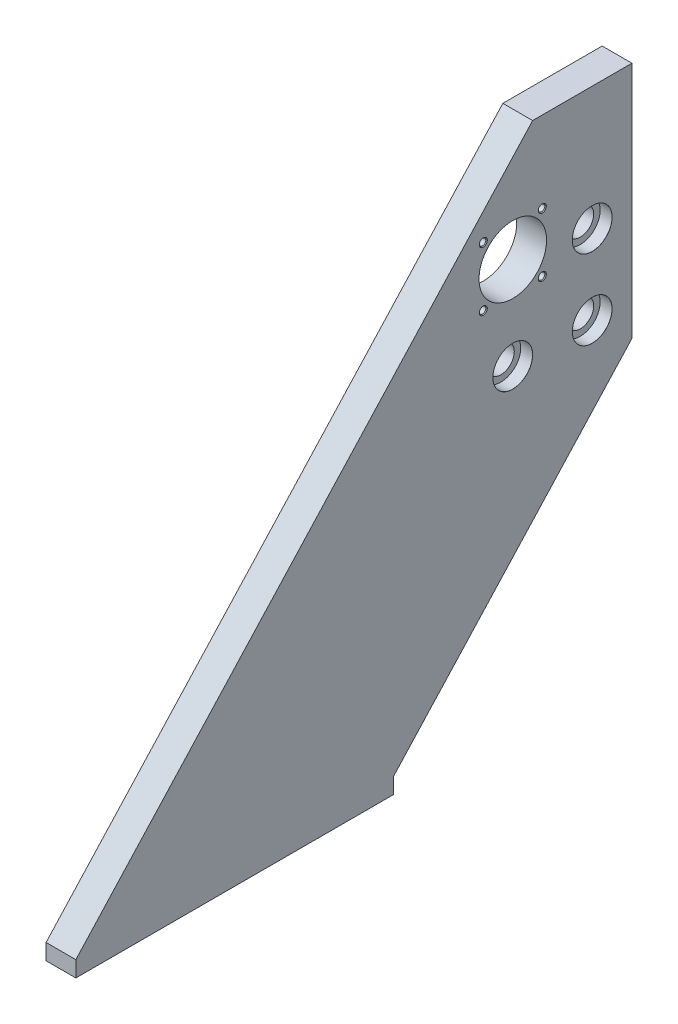
from build123d import *

# Parameters (mm, degrees)
EXTRUDE_703_DEPTH          = 7.5
HOLE_WIZARD_M8_D           = 6.8
HOLE_WIZARD_M8_DEPTH       = 30
HOLE_WIZARD_M8_TIP         = 2.042926105
HOLE_WIZARD_M12_AT_2_COUNT = 2
HOLE_WIZARD_M12_AT_2_PITCH = 40
HOLE_WIZARD_M12_AT_3_COUNT = 2
HOLE_WIZARD_M12_AT_3_PITCH = 56.568542495
SKETCH_10_R                = 17
CUT_EXTRUDE_1_DEPTH        = 328.504072273
FK10_M4_D                  = 3.3
FK10_M4_CSINK_D            = 4.05
FK10_M4_CSINK_ANGLE        = 90


with BuildPart() as part:
    # Эскиз1 → Extrude 703 (new, symmetric)
    with BuildSketch(Plane(origin=(0, 0, 0), x_dir=(0, 0, -1), z_dir=(1, 0, 0))):
        Polygon((-80, 0), (0, 0), (80, 0), (80, 8), (200, 138.909090909), (200, 258.909090909), (150, 258.909090909), (-80, 8), align=None)
    extrude(amount=EXTRUDE_703_DEPTH, both=True)

    # Крепление к плите M8
    with Locations(Plane(origin=(0, 0, 0), x_dir=(-1, 0, 0), z_dir=(0, -1, 0))):
        with Locations((0, -50), (0, 50)):
            Hole(HOLE_WIZARD_M8_D / 2, depth=HOLE_WIZARD_M8_DEPTH)
            with Locations((0, 0, -(HOLE_WIZARD_M8_DEPTH + HOLE_WIZARD_M8_TIP / 2))):  # 118° drill point
                Cone(0, HOLE_WIZARD_M8_D / 2, HOLE_WIZARD_M8_TIP, mode=Mode.SUBTRACT)

    # Эскиз9 → К профилю M12 (revolve, cut)
    with BuildSketch(Plane(origin=(7.5, 196.809090909, -180), x_dir=(0, 0, -1), z_dir=(0, 1, 0))):
        Polygon((0, 0), (0, 15), (6.75, 15), (6.75, 6), (10, 6), (10, 0.025), (10.025, 0), align=None)
    hole_wizard_m12 = revolve(axis=Axis((13.85, 196.809090909, -180), (-1, 0, 0)), mode=Mode.SUBTRACT)

    # К профилю M12 at 2: К профилю M12 ×2
    with Locations(*[(0, -i * HOLE_WIZARD_M12_AT_2_PITCH, 0) for i in range(1, HOLE_WIZARD_M12_AT_2_COUNT)]):
        add(hole_wizard_m12, mode=Mode.SUBTRACT)

    # К профилю M12 at 3: К профилю M12 ×2
    with Locations(*[Vector(0, -0.7071067811865474, 0.7071067811865478) * (i * HOLE_WIZARD_M12_AT_3_PITCH) for i in range(1, HOLE_WIZARD_M12_AT_3_COUNT)]):
        add(hole_wizard_m12, mode=Mode.SUBTRACT)

    # Эскиз10 → Вырез-Вытянуть1 (cut, through all)
    with BuildSketch(Plane(origin=(7.5, 0, 0), x_dir=(0, 0, -1), z_dir=(1, 0, 0))):
        with Locations((140, 203.3)):
            Circle(SKETCH_10_R)
    extrude(amount=-CUT_EXTRUDE_1_DEPTH, mode=Mode.SUBTRACT)

    # FK10 - M4 (through all)
    with Locations(Plane(origin=(7.5, 0, 0), x_dir=(0, 0, -1), z_dir=(1, 0, 0))):
        with Locations((154.849242405, 218.149242405), (154.849242405, 188.450757595), (125.150757595, 188.450757595), (125.150757595, 218.149242405)):
            CounterSinkHole(FK10_M4_D / 2, FK10_M4_CSINK_D / 2, counter_sink_angle=FK10_M4_CSINK_ANGLE)


solid = part.part
